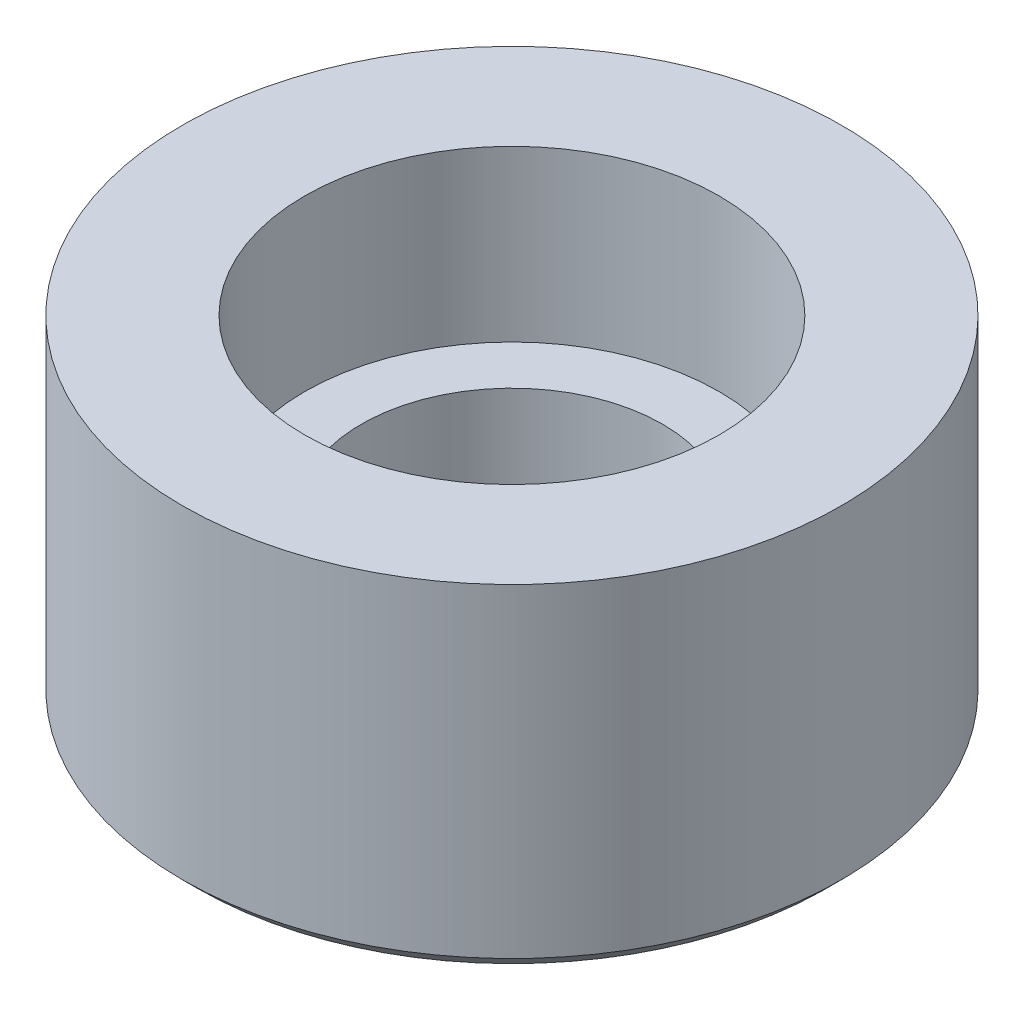
from build123d import *

# Parameters (mm, degrees)
SKETCH1_R           = 8.75
SKETCH1_R_2         = 4
BOSS_EXTRUDE1_DEPTH = 9
SKETCH2_R           = 5.5
CUT_EXTRUDE1_DEPTH  = 4.5
CHAMFER1_SIZE       = 0.4
CHAMFER1_SIZE2      = 0.399999869


with BuildPart() as part:
    # Sketch1 → Boss-Extrude1 (new body)
    with BuildSketch(Plane(origin=(0, 0, 0), x_dir=(1, 0, 0), z_dir=(0, 1, 0))):
        with Locations(Location((0, 0, 0), (0, 0, 270))):
            Circle(SKETCH1_R)
        with Locations(Location((0, 0, 0), (0, 0, 270))):
            Circle(SKETCH1_R_2, mode=Mode.SUBTRACT)
    extrude(amount=BOSS_EXTRUDE1_DEPTH)

    # Sketch2 → Cut-Extrude1 (cut, symmetric)
    with BuildSketch(Plane(origin=(0, 9, 0), x_dir=(1, 0, 0), z_dir=(0, 1, 0))):
        with Locations(Location((0, 0, 0), (0, 0, 270))):
            Circle(SKETCH2_R)
    extrude(amount=CUT_EXTRUDE1_DEPTH, both=True, mode=Mode.SUBTRACT)

    # Chamfer1
    chamfer1_edges = [part.edges().sort_by_distance(p)[0] for p in [
        (0, 0, -8.75),
    ]]
    chamfer1_side = [part.faces().sort_by_distance(p)[0] for p in [
        (0, 4.5, -8.75),
    ]]
    chamfer(chamfer1_edges, length=CHAMFER1_SIZE, length2=CHAMFER1_SIZE2, reference=chamfer1_side[0])


solid = part.part
